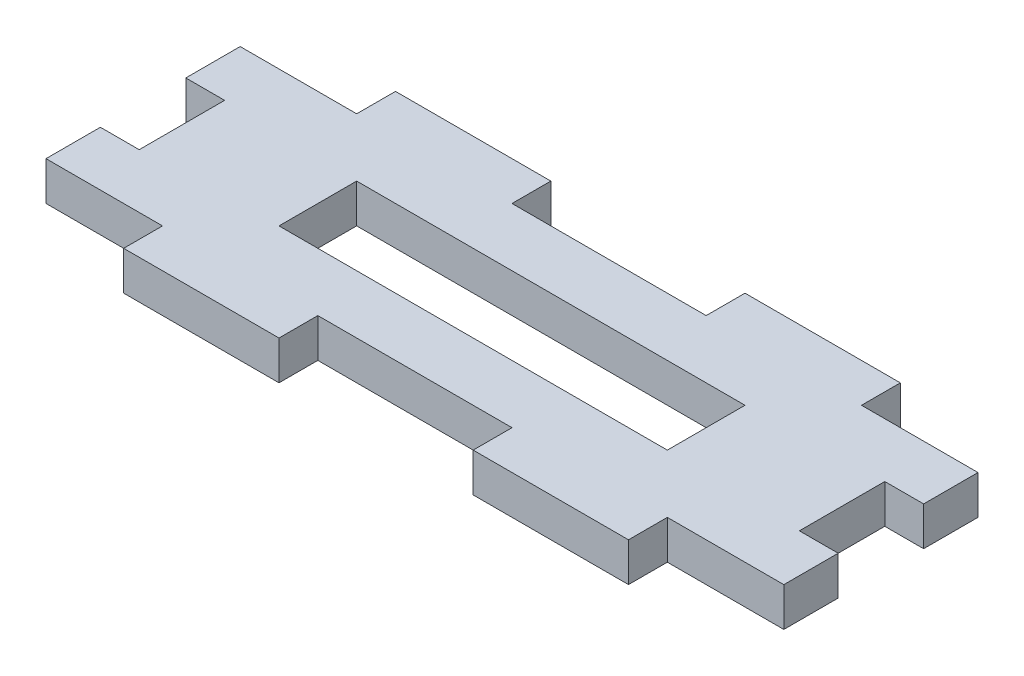
from build123d import *

# Parameters (mm, degrees)
SKETCH1_W           = 50
SKETCH1_H           = 10
BOSS_EXTRUDE1_DEPTH = 5


with BuildPart() as part:
    # Sketch1 → Boss-Extrude1 (new body)
    with BuildSketch(Plane(origin=(0, 0, 0), x_dir=(1, 0, 0), z_dir=(0, 1, 0))):
        Polygon((-12.5, 12.5), (12.5, 12.5), (12.5, 17.5), (32.5, 17.5), (32.5, 12.5), (47.5, 12.5), (47.5, 5.5), (42.5, 5.5), (42.5, -5.5), (47.5, -5.5), (47.5, -12.5), (32.5, -12.5), (32.5, -17.5), (12.5, -17.5), (12.5, -12.5), (-12.5, -12.5), (-12.5, -17.5), (-32.5, -17.5), (-32.5, -12.5), (-47.5, -12.5), (-47.5, -5.5), (-42.5, -5.5), (-42.5, 5.5), (-47.5, 5.5), (-47.5, 12.5), (-32.5, 12.5), (-32.5, 17.5), (-12.5, 17.5), align=None)
        Rectangle(SKETCH1_W, SKETCH1_H, mode=Mode.SUBTRACT)
    extrude(amount=BOSS_EXTRUDE1_DEPTH)


solid = part.part
